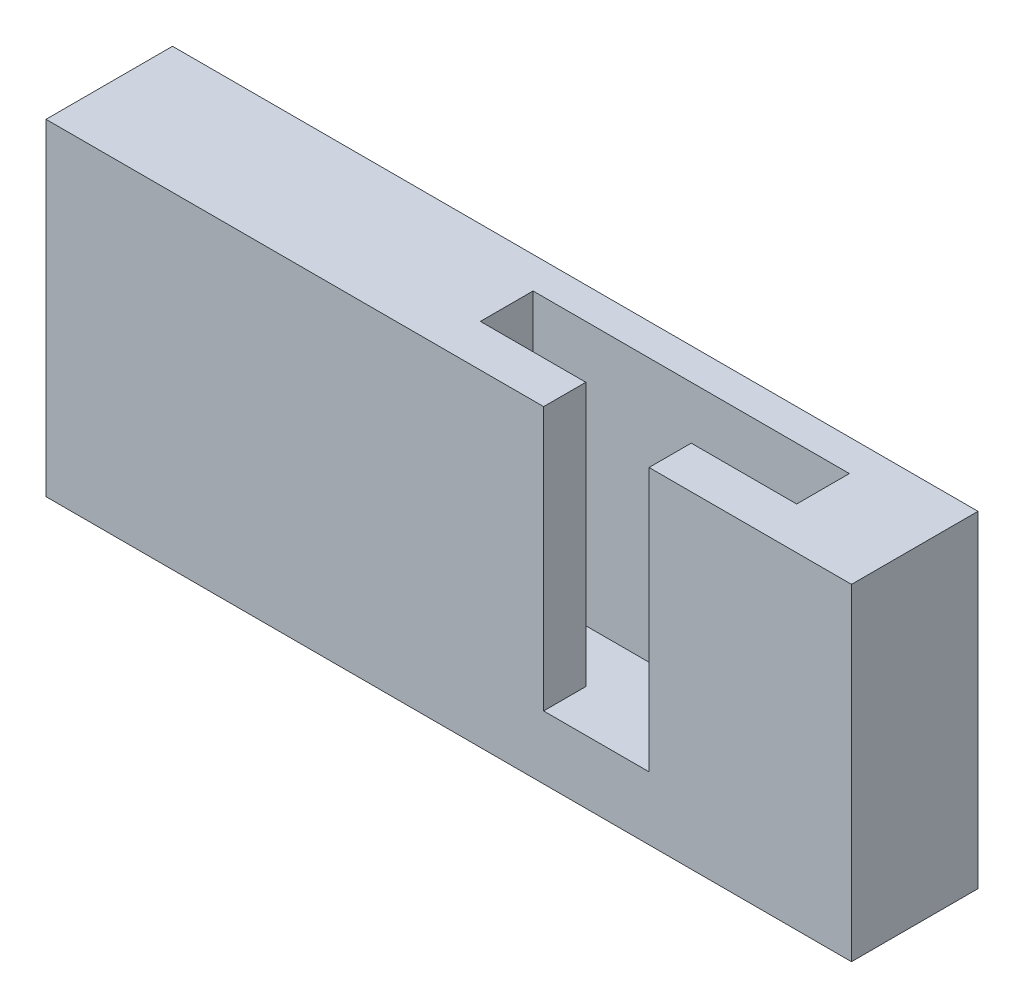
from build123d import *

# Parameters (mm, degrees)
SKETCH2_W           = 39
SKETCH2_H           = 15.5
BOSS_EXTRUDE1_DEPTH = 6
CUT_EXTRUDE1_DEPTH  = 12.5
SKETCH4_W           = 20.319843286
SKETCH4_H           = 28.236665345
CUT_EXTRUDE2_DEPTH  = 0.4
SKETCH5_W           = 11.083550883
SKETCH5_H           = 22.584934042
CUT_EXTRUDE3_DEPTH  = 0.4


with BuildPart() as part:
    # Sketch2 → Boss-Extrude1 (new body)
    with BuildSketch(Plane.XY):
        with Locations((19.5, 7.75)):
            Rectangle(SKETCH2_W, SKETCH2_H)
    extrude(amount=-BOSS_EXTRUDE1_DEPTH)

    # Sketch3 → Cut-Extrude1 (cut)
    with BuildSketch(Plane(origin=(0, 15.5, 0), x_dir=(1, 0, 0), z_dir=(0, 1, 0))):
        Polygon((24, 0), (24, 2), (19, 2), (19, 4.5), (34, 4.5), (34, 2), (29, 2), (29, 0), align=None)
    extrude(amount=-CUT_EXTRUDE1_DEPTH, mode=Mode.SUBTRACT)

    # Sketch4 → Cut-Extrude2 (cut)
    with BuildSketch(Plane(origin=(39, 0, 0), x_dir=(0, 0, -1), z_dir=(1, 0, 0))):
        with Locations((6.654932851, 5.177032831)):
            Rectangle(SKETCH4_W, SKETCH4_H)
    extrude(amount=-CUT_EXTRUDE2_DEPTH, mode=Mode.SUBTRACT)

    # Sketch5 → Cut-Extrude3 (cut)
    with BuildSketch(Plane.ZY):
        with Locations((-2.571172138, 7.134247173)):
            Rectangle(SKETCH5_W, SKETCH5_H)
    extrude(amount=-CUT_EXTRUDE3_DEPTH, mode=Mode.SUBTRACT)


solid = part.part
